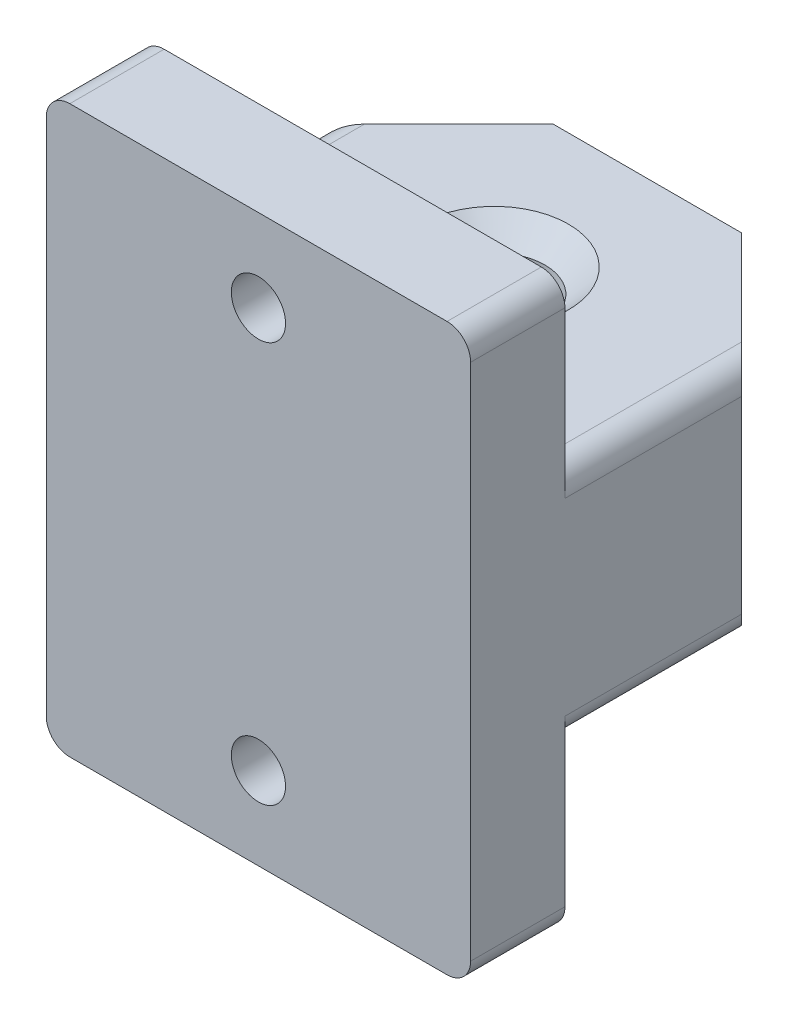
from build123d import *

# Parameters (mm, degrees)
SKETCH_1_W             = 18
SKETCH_1_H             = 10
EXTRUDE_1_DEPTH        = 23
SKETCH_3_R             = 2.15
CUT_EXTRUDE_1_DEPTH    = 23
FILLET_1_R             = 1
SKETCH_4_W             = 18
SKETCH_4_H             = 6.5
CUT_EXTRUDE_2_DEPTH    = 23
SKETCH_5_W             = 18
SKETCH_5_H             = 12
EXTRUDE_2_DEPTH        = 4
SKETCH_6_R             = 1.15
CUT_EXTRUDE_3_DEPTH    = 4
FILLET_2_R             = 1
CHAMFER_1_SIZE         = 1
FILLET_2_OF_MIRROR_1_R = 1
CHAMFER_2_SIZE         = 0.5
CUT_EXTRUDE_4_DEPTH    = 10


with BuildPart() as part:
    # 草图1 → 凸台-拉伸1 (new body)
    with BuildSketch(Plane.XY):
        Rectangle(SKETCH_1_W, SKETCH_1_H)
    extrude(amount=EXTRUDE_1_DEPTH)

    # 草图3 → 切除-拉伸1 (cut)
    with BuildSketch(Plane(origin=(0, 5, 0), x_dir=(1, 0, 0), z_dir=(0, 1, 0))):
        with Locations(Location((0, -13, 0), (0, 0, 270))):
            Circle(SKETCH_3_R)
    extrude(amount=-CUT_EXTRUDE_1_DEPTH, mode=Mode.SUBTRACT)

    # 圆角1
    fillet_1_edges = [part.edges().sort_by_distance(p)[0] for p in [
        (9, -5, 11.5),
        (-9, -5, 11.5),
        (-9, 5, 11.5),
        (9, 5, 11.5),
    ]]
    fillet(fillet_1_edges, radius=FILLET_1_R)

    # 草图4 → 切除-拉伸2 (cut)
    with BuildSketch(Plane(origin=(0, 5, 0), x_dir=(1, 0, 0), z_dir=(0, 1, 0))):
        with Locations((0, -3.25)):
            Rectangle(SKETCH_4_W, SKETCH_4_H)
    extrude(amount=-CUT_EXTRUDE_2_DEPTH, mode=Mode.SUBTRACT)

    # 草图5 → 凸台-拉伸2 (add)
    with BuildSketch(Plane.XY.offset(23)):
        with Locations((0, 6)):
            Rectangle(SKETCH_5_W, SKETCH_5_H)
    extrude_2 = extrude(amount=-EXTRUDE_2_DEPTH)

    # 草图6 → 切除-拉伸3 (cut)
    with BuildSketch(Plane(origin=(0, 0, 19), x_dir=(-1, 0, 0), z_dir=(0, 0, -1))):
        with Locations((0, 8.5)):
            Circle(SKETCH_6_R)
    cut_extrude_3 = extrude(amount=-CUT_EXTRUDE_3_DEPTH, mode=Mode.SUBTRACT)

    # 圆角2
    fillet_2_edges = [part.edges().sort_by_distance(p)[0] for p in [
        (9, 12, 21),
        (-9, 12, 21),
    ]]
    fillet(fillet_2_edges, radius=FILLET_2_R)

    # 倒角1
    chamfer_1_edges = [part.edges().sort_by_distance(p)[0] for p in [
        (1.15, 8.5, 19),
        (0, -5, 10.85),
        (0, 5, 10.85),
    ]]
    chamfer(chamfer_1_edges, length=CHAMFER_1_SIZE)

    # 镜向1: 凸台-拉伸2, 切除-拉伸3 across plane
    add(extrude_2.mirror(Plane.ZX))
    add(cut_extrude_3.mirror(Plane.ZX), mode=Mode.SUBTRACT)

    # 圆角2 of 镜向1
    fillet_2_of_mirror_1_edges = [part.edges().sort_by_distance(p)[0] for p in [
        (9, -12, 21),
        (-9, -12, 21),
    ]]
    fillet(fillet_2_of_mirror_1_edges, radius=FILLET_2_OF_MIRROR_1_R)

    # 倒角2
    chamfer_2_edges = [part.edges().sort_by_distance(p)[0] for p in [
        (1.15, -8.5, 19),
    ]]
    chamfer(chamfer_2_edges, length=CHAMFER_2_SIZE)

    # 草图7 → 切除-拉伸4 (cut)
    with BuildSketch(Plane(origin=(0, 5, 0), x_dir=(1, 0, 0), z_dir=(0, 1, 0))):
        Polygon((-9, -11.5), (-4, -6.5), (-9, -6.5), align=None)
        Polygon((9, -11.5), (4, -6.5), (9, -6.5), align=None)
    extrude(amount=-CUT_EXTRUDE_4_DEPTH, mode=Mode.SUBTRACT)


solid = part.part
